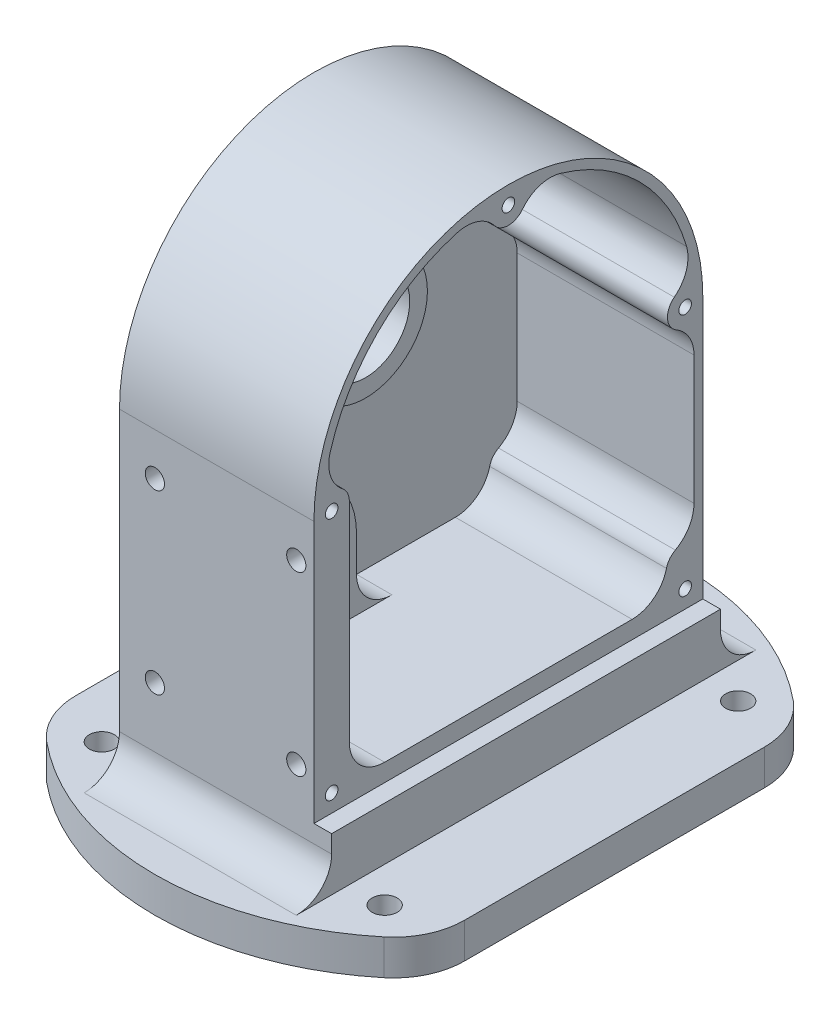
from build123d import *

# Parameters (mm, degrees)
BOSS_EXTRUDE1_DEPTH                               = 17.4625
SKETCH2_R                                         = 11.253999971
CUT_EXTRUDE1_DEPTH                                = 6.35
SKETCH3_R                                         = 5.127000033
CUT_EXTRUDE2_DEPTH                                = 62.154818903
CUT_EXTRUDE3_START                                = -25.4
SKETCH4_R                                         = 11.253999971
CUT_EXTRUDE3_DEPTH                                = 25.4
CSK_FOR_M2_5_FLAT_HEAD_MACHINE_SCREW1_D           = 2.9
CSK_FOR_M2_5_FLAT_HEAD_MACHINE_SCREW1_CSINK_D     = 5.5
CSK_FOR_M2_5_FLAT_HEAD_MACHINE_SCREW1_CSINK_ANGLE = 90
CIRPATTERN1_COUNT                                 = 3
CUT_EXTRUDE4_DEPTH                                = 25.4
CUT_EXTRUDE5_DEPTH                                = 6.35
FILLET1_R                                         = 6.35
SKETCH9_R                                         = 7.9375
CUT_EXTRUDE6_DEPTH                                = 63.701226065
CHAMFER1_SIZE                                     = 1.27
BOSS_EXTRUDE2_START                               = 6.096
SKETCH10_R                                        = 11.1125
SKETCH10_R_2                                      = 7.9375
BOSS_EXTRUDE2_DEPTH                               = 6.096
F_4_40_TAPPED_HOLE2_D                             = 2.2606
F_4_40_TAPPED_HOLE2_DEPTH                         = 12.7
F_4_40_TAPPED_HOLE2_TIP                           = 0.679152758
CUT_EXTRUDE7_DEPTH                                = 25.4
FILLET3_R                                         = 3.175
CUT_EXTRUDE13_DEPTH                               = 6.35
BOSS_EXTRUDE3_DEPTH                               = 15.875
SKETCH22_W                                        = 15.875
SKETCH22_H                                        = 9.525
CUT_EXTRUDE8_DEPTH                                = 107.835329626
CUT_EXTRUDE8_DIRECTION_2_REACH                    = 108.835
F_8_CLEARANCE_HOLE1_D                             = 4.4958
F_8_CLEARANCE_HOLE1_DEPTH                         = 6.35
F_8_CLEARANCE_HOLE1_TIP                           = 1.350674586
SKETCH25_W                                        = 28.575
SKETCH25_H                                        = 63.5
CUT_EXTRUDE9_DEPTH                                = 3.175
SKETCH26_W                                        = 25.4
SKETCH26_H                                        = 57.15
CUT_EXTRUDE10_DEPTH                               = 12.7
FILLET5_R                                         = 3.175
CUT_EXTRUDE11_DEPTH                               = 107.835329626
CUT_EXTRUDE11_DIRECTION_2_REACH                   = 108.835
FILLET7_R                                         = 12.7
FILLET8_R                                         = 3.175
CUT_EXTRUDE12_START                               = -9.525
CUT_EXTRUDE12_DEPTH                               = 9.525
BOSS_EXTRUDE4_REACH                               = 92.083
FILLET11_R                                        = 6.35
F_8_32_TAPPED_HOLE2_D                             = 3.4544
F_8_32_TAPPED_HOLE2_DEPTH                         = 7.62
F_8_32_TAPPED_HOLE2_TIP                           = 1.037806461
FILLET12_R                                        = 6.35
FILLET13_R                                        = 6.35


with BuildPart() as part:
    # Sketch1 → Boss-Extrude1 (new, symmetric)
    with BuildSketch(Plane(origin=(0, 0, 0), x_dir=(0, 0, -1), z_dir=(1, 0, 0))):
        with BuildLine():
            Line((-34.925, 5.715), (-34.925, -41.275))
            Line((-34.925, -41.275), (34.925, -41.275))
            Line((34.925, -41.275), (34.925, 5.715))
            ThreePointArc((34.925, 5.715), (0, 40.64), (-34.925, 5.715))
        make_face()
    extrude(amount=BOSS_EXTRUDE1_DEPTH, both=True)

    # Sketch2 → Cut-Extrude1 (cut)
    with BuildSketch(Plane.ZY.offset(17.4625)):
        with Locations((15.875, -25.393519733)):
            Circle(SKETCH2_R)
    extrude(amount=-CUT_EXTRUDE1_DEPTH, mode=Mode.SUBTRACT)

    # Sketch3 → Cut-Extrude2 (cut, through all)
    with BuildSketch(Plane.ZY.offset(11.1125)):
        with Locations((15.875, -25.393519733)):
            Circle(SKETCH3_R)
    extrude(amount=-CUT_EXTRUDE2_DEPTH, mode=Mode.SUBTRACT)

    # Sketch4 → Cut-Extrude3 (cut)
    with BuildSketch(Plane(origin=(17.4625, 0, 0), x_dir=(0, 0, -1), z_dir=(1, 0, 0)).offset(CUT_EXTRUDE3_START)):
        with Locations(Location((-15.875, -25.393519733, 0), (0, 0, 180))):
            Circle(SKETCH4_R)
    extrude(amount=CUT_EXTRUDE3_DEPTH, mode=Mode.SUBTRACT)

    # CSK for M2.5 Flat Head Machine Screw1 (through all)
    with Locations(Plane(origin=(-7.9375, 0, 0), x_dir=(0, 0, -1), z_dir=(1, 0, 0))):
        with Locations((-15.875, -18.393519733)):
            csk_for_m2_5_flat_head_machine_screw1 = CounterSinkHole(CSK_FOR_M2_5_FLAT_HEAD_MACHINE_SCREW1_D / 2, CSK_FOR_M2_5_FLAT_HEAD_MACHINE_SCREW1_CSINK_D / 2, counter_sink_angle=CSK_FOR_M2_5_FLAT_HEAD_MACHINE_SCREW1_CSINK_ANGLE)

    # CirPattern1: CSK for M2.5 Flat Head Machine Screw1 ×3 about axis
    cirpattern1_axis = Axis((0, -25.393519733, 15.875), (1, 0, 0))
    for i in range(1, CIRPATTERN1_COUNT):
        add(csk_for_m2_5_flat_head_machine_screw1.rotate(cirpattern1_axis, i * 360 / CIRPATTERN1_COUNT), mode=Mode.SUBTRACT)

    # Sketch7 → Cut-Extrude4 (cut)
    with BuildSketch(Plane(origin=(17.4625, 0, 0), x_dir=(0, 0, -1), z_dir=(1, 0, 0))):
        with BuildLine():
            Line((28.575, -38.1), (-28.575, -38.1))
            Line((-28.575, -38.1), (-28.575, 5.715))
            ThreePointArc((-28.575, 5.715), (0, 34.29), (28.575, 5.715))
            Line((28.575, 5.715), (28.575, -38.1))
        make_face()
    extrude(amount=-CUT_EXTRUDE4_DEPTH, mode=Mode.SUBTRACT)

    # Sketch8 → Cut-Extrude5 (cut)
    with BuildSketch(Plane(origin=(-7.9375, 0, 0), x_dir=(0, 0, -1), z_dir=(1, 0, 0))):
        with BuildLine():
            Line((-15.875, -11.393519733), (-28.575, -11.393519733))
            Line((-28.575, -11.393519733), (-28.575, 5.715))
            ThreePointArc((-28.575, 5.715), (0, 34.29), (28.575, 5.715))
            Line((28.575, 5.715), (28.575, -38.1))
            Line((28.575, -38.1), (-1.875, -38.1))
            Line((-1.875, -38.1), (-1.875, -25.393519733))
            ThreePointArc((-1.875, -25.393519733), (-5.975505063, -15.494024797), (-15.875, -11.393519733))
        make_face()
    extrude(amount=-CUT_EXTRUDE5_DEPTH, mode=Mode.SUBTRACT)

    # Fillet1
    fillet1_edges = [part.edges().sort_by_distance(p)[0] for p in [
        (4.7625, -38.1, 28.575),
        (1.5875, -38.1, -28.575),
        (-11.1125, -38.1, 1.875),
        (-11.1125, -11.393519733, 28.575),
    ]]
    fillet(fillet1_edges, radius=FILLET1_R)

    # Sketch9 → Cut-Extrude6 (cut, through all)
    with BuildSketch(Plane(origin=(-14.2875, 0, 0), x_dir=(0, 0, -1), z_dir=(1, 0, 0))):
        with Locations((0, 5.715)):
            Circle(SKETCH9_R)
    extrude(amount=-CUT_EXTRUDE6_DEPTH, mode=Mode.SUBTRACT)

    # Chamfer1
    chamfer1_edges = [part.edges().sort_by_distance(p)[0] for p in [
        (-17.4625, -25.393519733, 4.621000029),
    ]]
    chamfer(chamfer1_edges, length=CHAMFER1_SIZE)

    # Sketch10 → Boss-Extrude2 (add)
    with BuildSketch(Plane(origin=(-14.2875, 0, 0), x_dir=(0, 0, -1), z_dir=(1, 0, 0)).offset(BOSS_EXTRUDE2_START)):
        with Locations((0, 5.715)):
            Circle(SKETCH10_R)
        with Locations((0, 5.715)):
            Circle(SKETCH10_R_2, mode=Mode.SUBTRACT)
    extrude(amount=-BOSS_EXTRUDE2_DEPTH)

    # #4-40 Tapped Hole2
    with Locations(Plane(origin=(17.4625, 0, 0), x_dir=(0, 0, -1), z_dir=(1, 0, 0))):
        with Locations((0, 37.465), (-31.75, 5.715), (31.75, 5.715), (31.75, -38.1), (-31.75, -38.1)):
            Hole(F_4_40_TAPPED_HOLE2_D / 2, depth=F_4_40_TAPPED_HOLE2_DEPTH)
            with Locations((0, 0, -(F_4_40_TAPPED_HOLE2_DEPTH + F_4_40_TAPPED_HOLE2_TIP / 2))):  # 118° drill point
                Cone(0, F_4_40_TAPPED_HOLE2_D / 2, F_4_40_TAPPED_HOLE2_TIP, mode=Mode.SUBTRACT)

    # Sketch17 → Cut-Extrude7 (cut)
    with BuildSketch(Plane(origin=(17.4625, 0, 0), x_dir=(0, 0, -1), z_dir=(1, 0, 0))):
        with BuildLine():
            ThreePointArc((-29.8053125, 8.224744116), (-28.899122257, 7.112541088), (-28.575, 5.715))
            ThreePointArc((-28.575, 5.715), (-20.205576272, 25.920576272), (0, 34.29))
            ThreePointArc((0, 34.29), (-1.397541088, 34.614122257), (-2.509744116, 35.5203125))
            ThreePointArc((-2.509744116, 35.5203125), (-5.565414565, 37.669639324), (-9.30081643, 37.728805147))
            ThreePointArc((-9.30081643, 37.728805147), (-23.573172318, 29.288172318), (-32.013805147, 15.01581643))
            ThreePointArc((-32.013805147, 15.01581643), (-31.954639324, 11.280414565), (-29.8053125, 8.224744116))
        make_face()
        with BuildLine():
            ThreePointArc((2.509744116, 35.5203125), (1.397541088, 34.614122257), (0, 34.29))
            ThreePointArc((0, 34.29), (20.205576272, 25.920576272), (28.575, 5.715))
            ThreePointArc((28.575, 5.715), (28.899122257, 7.112541088), (29.8053125, 8.224744116))
            ThreePointArc((29.8053125, 8.224744116), (31.954639324, 11.280414565), (32.013805147, 15.01581643))
            ThreePointArc((32.013805147, 15.01581643), (23.573172318, 29.288172318), (9.30081643, 37.728805147))
            ThreePointArc((9.30081643, 37.728805147), (5.565414565, 37.669639324), (2.509744116, 35.5203125))
        make_face()
        with BuildLine():
            ThreePointArc((30.1625, 2.965369343), (29.000369343, 4.1275), (28.575, 5.715))
            Line((28.575, 5.715), (28.575, -31.75))
            ThreePointArc((28.575, -31.75), (32.007615786, -29.490203905), (33.3375, -25.601638938))
            Line((33.3375, -25.601638938), (33.3375, -2.533891971))
            ThreePointArc((33.3375, -2.533891971), (32.486761314, 0.641108029), (30.1625, 2.965369343))
        make_face()
        with BuildLine():
            ThreePointArc((-30.1625, 2.965369343), (-32.486761314, 0.641108029), (-33.3375, -2.533891971))
            Line((-33.3375, -2.533891971), (-33.3375, -25.601638938))
            ThreePointArc((-33.3375, -25.601638938), (-32.007615786, -29.490203905), (-28.575, -31.75))
            Line((-28.575, -31.75), (-28.575, 5.715))
            ThreePointArc((-28.575, 5.715), (-29.000369343, 4.1275), (-30.1625, 2.965369343))
        make_face()
    extrude(amount=-CUT_EXTRUDE7_DEPTH, mode=Mode.SUBTRACT)

    # Fillet3
    fillet3_edges = [part.edges().sort_by_distance(p)[0] for p in [
        (4.7625, -31.75, 28.575),
        (4.7625, -31.75, -28.575),
    ]]
    fillet(fillet3_edges, radius=FILLET3_R)

    # Sketch31 → Cut-Extrude13 (cut)
    with BuildSketch(Plane(origin=(-7.9375, 0, 0), x_dir=(0, 0, -1), z_dir=(1, 0, 0))):
        with BuildLine():
            ThreePointArc((-30.1625, 2.965369343), (-32.486761314, 0.641108029), (-33.3375, -2.533891971))
            Line((-33.3375, -2.533891971), (-33.3375, -11.393519733))
            Line((-33.3375, -11.393519733), (-22.225, -11.393519733))
            ThreePointArc((-22.225, -11.393519733), (-26.715128061, -9.533647794), (-28.575, -5.043519733))
            Line((-28.575, -5.043519733), (-28.575, 5.715))
            ThreePointArc((-28.575, 5.715), (-29.000369343, 4.1275), (-30.1625, 2.965369343))
        make_face()
        with BuildLine():
            ThreePointArc((-29.8053125, 8.224744116), (-28.899122257, 7.112541088), (-28.575, 5.715))
            ThreePointArc((-28.575, 5.715), (-20.205576272, 25.920576272), (0, 34.29))
            ThreePointArc((0, 34.29), (-1.397541088, 34.614122257), (-2.509744116, 35.5203125))
            ThreePointArc((-2.509744116, 35.5203125), (-5.565414565, 37.669639324), (-9.30081643, 37.728805147))
            ThreePointArc((-9.30081643, 37.728805147), (-23.573172318, 29.288172318), (-32.013805147, 15.01581643))
            ThreePointArc((-32.013805147, 15.01581643), (-31.954639324, 11.280414565), (-29.8053125, 8.224744116))
        make_face()
        with BuildLine():
            ThreePointArc((2.509744116, 35.5203125), (1.397541088, 34.614122257), (0, 34.29))
            ThreePointArc((0, 34.29), (20.205576272, 25.920576272), (28.575, 5.715))
            ThreePointArc((28.575, 5.715), (28.899122257, 7.112541088), (29.8053125, 8.224744116))
            ThreePointArc((29.8053125, 8.224744116), (31.954639324, 11.280414565), (32.013805147, 15.01581643))
            ThreePointArc((32.013805147, 15.01581643), (23.573172318, 29.288172318), (9.30081643, 37.728805147))
            ThreePointArc((9.30081643, 37.728805147), (5.565414565, 37.669639324), (2.509744116, 35.5203125))
        make_face()
        with BuildLine():
            ThreePointArc((30.1625, 2.965369343), (29.000369343, 4.1275), (28.575, 5.715))
            Line((28.575, 5.715), (28.575, -31.75))
            ThreePointArc((28.575, -31.75), (28.529894241, -32.505518767), (28.395217762, -33.250304227))
            ThreePointArc((28.395217762, -33.250304227), (28.97026875, -32.056173857), (29.982717762, -31.20085054))
            ThreePointArc((29.982717762, -31.20085054), (32.43461542, -28.865292352), (33.3375, -25.601638938))
            Line((33.3375, -25.601638938), (33.3375, -2.533891971))
            ThreePointArc((33.3375, -2.533891971), (32.486761314, 0.641108029), (30.1625, 2.965369343))
        make_face()
    extrude(amount=-CUT_EXTRUDE13_DEPTH, mode=Mode.SUBTRACT)

    # Sketch21 → Boss-Extrude3 (add)
    with BuildSketch(Plane.XZ.offset(41.275)):
        with BuildLine():
            Line((-33.3375, -32.378773911), (-33.3375, 32.378773911))
            ThreePointArc((-33.3375, 32.378773911), (1.5875, 47.625), (36.5125, 32.378773911))
            Line((36.5125, 32.378773911), (36.5125, -32.378773911))
            ThreePointArc((36.5125, -32.378773911), (1.5875, -47.625), (-33.3375, -32.378773911))
        make_face()
    extrude(amount=BOSS_EXTRUDE3_DEPTH)

    # Sketch22 → Cut-Extrude8 (cut)
    with BuildSketch(Plane.XY.offset(34.925)):
        with Locations((28.575, -46.0375)):
            Rectangle(SKETCH22_W, SKETCH22_H)
    cut_extrude8 = extrude(amount=-CUT_EXTRUDE8_DEPTH, mode=Mode.SUBTRACT)

    # Sketch22 → Cut-Extrude8 direction 2 (cut, up to next)
    with BuildSketch(Plane.XY.offset(34.925), mode=Mode.PRIVATE) as cut_extrude8_direction_2_sk1:
        with Locations((28.575, -46.0375)):
            Rectangle(SKETCH22_W, SKETCH22_H)
    cut_extrude8_direction_2_tool1 = extrude(cut_extrude8_direction_2_sk1.sketch, amount=CUT_EXTRUDE8_DIRECTION_2_REACH, mode=Mode.PRIVATE) & part.part
    cut_extrude8_direction_2 = cut_extrude8_direction_2_tool1.solids().sort_by_distance((28.575, -46.0375, 34.925))[0]
    add(cut_extrude8_direction_2, mode=Mode.SUBTRACT)

    # Mirror1: Cut-Extrude8, Cut-Extrude8 direction 2 across plane
    add(cut_extrude8.mirror(Plane(origin=(0, 0, 0), x_dir=(0, 0, 1), z_dir=(1, 0, 0))), mode=Mode.SUBTRACT)
    add(cut_extrude8_direction_2.mirror(Plane(origin=(0, 0, 0), x_dir=(0, 0, 1), z_dir=(1, 0, 0))), mode=Mode.SUBTRACT)

    # #8 Clearance Hole1
    with Locations(Plane.XZ.offset(57.15)):
        with Locations((26.9875, 31.75), (-23.8125, 31.75), (-23.8125, -31.75), (26.9875, -31.75)):
            Hole(F_8_CLEARANCE_HOLE1_D / 2, depth=F_8_CLEARANCE_HOLE1_DEPTH)
            with Locations((0, 0, -(F_8_CLEARANCE_HOLE1_DEPTH + F_8_CLEARANCE_HOLE1_TIP / 2))):  # 118° drill point
                Cone(0, F_8_CLEARANCE_HOLE1_D / 2, F_8_CLEARANCE_HOLE1_TIP, mode=Mode.SUBTRACT)

    # Sketch25 → Cut-Extrude9 (cut)
    with BuildSketch(Plane.XZ.offset(57.15)):
        Rectangle(SKETCH25_W, SKETCH25_H)
    extrude(amount=-CUT_EXTRUDE9_DEPTH, mode=Mode.SUBTRACT)

    # Sketch26 → Cut-Extrude10 (cut)
    with BuildSketch(Plane.XZ.offset(53.975)):
        Rectangle(SKETCH26_W, SKETCH26_H)
    extrude(amount=-CUT_EXTRUDE10_DEPTH, mode=Mode.SUBTRACT)

    # Fillet5
    fillet5_edges = [part.edges().sort_by_distance(p)[0] for p in [
        (14.2875, -55.5625, 31.75),
        (14.2875, -55.5625, -31.75),
        (-14.2875, -55.5625, -31.75),
        (-14.2875, -55.5625, 31.75),
        (12.7, -47.625, 28.575),
        (12.7, -47.625, -28.575),
        (-12.7, -47.625, -28.575),
        (-12.7, -47.625, 28.575),
        (12.7, -41.275, 0),
        (0, -41.275, -28.575),
        (-12.7, -41.275, 0),
        (0, -41.275, 28.575),
    ]]
    fillet(fillet5_edges, radius=FILLET5_R)

    # Sketch28 → Cut-Extrude11 (cut)
    with BuildSketch(Plane.XY.offset(34.925)):
        Polygon((-17.4625, -41.275), (-17.4625, -50.8), (-33.3375, -50.8), (-20.6375, -41.275), align=None)
    extrude(amount=-CUT_EXTRUDE11_DEPTH, mode=Mode.SUBTRACT)

    # Sketch28 → Cut-Extrude11 direction 2 (cut, up to next)
    with BuildSketch(Plane.XY.offset(34.925), mode=Mode.PRIVATE) as cut_extrude11_direction_2_sk1:
        Polygon((-17.4625, -41.275), (-17.4625, -50.8), (-33.3375, -50.8), (-20.6375, -41.275), align=None)
    cut_extrude11_direction_2_tool1 = extrude(cut_extrude11_direction_2_sk1.sketch, amount=CUT_EXTRUDE11_DIRECTION_2_REACH, mode=Mode.PRIVATE) & part.part
    add(cut_extrude11_direction_2_tool1.solids().sort_by_distance((-22.930556, -47.095833, 34.925))[0], mode=Mode.SUBTRACT)

    # Fillet7
    fillet7_edges = [part.edges().sort_by_distance(p)[0] for p in [
        (-33.3375, -53.975, -32.378773911),
        (36.5125, -53.975, -32.378773911),
        (36.5125, -53.975, 32.378773911),
        (-33.3375, -53.975, 32.378773911),
    ]]
    fillet(fillet7_edges, radius=FILLET7_R)

    # Fillet8
    fillet8_edges = [part.edges().sort_by_distance(p)[0] for p in [
        (-14.2875, 5.715, 11.1125),
    ]]
    fillet(fillet8_edges, radius=FILLET8_R)

    # Sketch30 → Cut-Extrude12 (cut)
    with BuildSketch(Plane(origin=(0, -41.275, 0), x_dir=(1, 0, 0), z_dir=(0, 1, 0)).offset(CUT_EXTRUDE12_START)):
        with BuildLine():
            Line((20.6375, 34.925), (-17.4625, 34.925))
            Line((-17.4625, 34.925), (-17.4625, 43.649033494))
            ThreePointArc((-17.4625, 43.649033494), (1.5875, 47.625), (20.6375, 43.649033494))
            Line((20.6375, 43.649033494), (20.6375, 34.925))
        make_face()
        with BuildLine():
            Line((20.6375, -43.649033494), (20.6375, -34.925))
            Line((20.6375, -34.925), (-17.4625, -34.925))
            Line((-17.4625, -34.925), (-17.4625, -43.649033494))
            ThreePointArc((-17.4625, -43.649033494), (1.5875, -47.625), (20.6375, -43.649033494))
        make_face()
    extrude(amount=CUT_EXTRUDE12_DEPTH, mode=Mode.SUBTRACT)

    # Boss-Extrude4: up to this face of the body (flat: up to its plane)
    boss_extrude4_end = Plane(part.part.faces().sort_by_distance((-14.2875, 5.715, 15.299125656))[0])
    # Sketch33 → Boss-Extrude4 (add, up to the picked face)
    with BuildSketch(Plane(origin=(17.4625, 0, 0), x_dir=(0, 0, -1), z_dir=(1, 0, 0)), mode=Mode.PRIVATE) as boss_extrude4_sk1:
        with BuildLine():
            Line((-28.582296907, 5.499867214), (-28.582296907, -32.703518156))
            ThreePointArc((-28.582296907, -32.703518156), (-29.157631612, -31.835805607), (-29.982717762, -31.20085054))
            ThreePointArc((-29.982717762, -31.20085054), (-32.43461542, -28.865292352), (-33.3375, -25.601638938))
            Line((-33.3375, -25.601638938), (-33.3375, -2.533891971))
            ThreePointArc((-33.3375, -2.533891971), (-32.486761314, 0.641108029), (-30.1625, 2.965369343))
            ThreePointArc((-30.1625, 2.965369343), (-29.055763749, 4.035203577), (-28.582296907, 5.499867214))
        make_face()
    boss_extrude4_tool1 = split(extrude(boss_extrude4_sk1.sketch, amount=-BOSS_EXTRUDE4_REACH, mode=Mode.PRIVATE), bisect_by=boss_extrude4_end, keep=Keep.BOTH, mode=Mode.PRIVATE)
    add(boss_extrude4_tool1.solids().sort_by(Axis((17.4625, -14.034093, 30.834221), (-1, 0, 0)))[0])

    # Fillet11
    fillet11_edges = [part.edges().sort_by_distance(p)[0] for p in [
        (4.7625, -32.703518156, 28.582296907),
    ]]
    fillet(fillet11_edges, radius=FILLET11_R)

    # #8-32 Tapped Hole2
    with Locations(Plane.XY.offset(34.925)):
        with Locations((-11.1125, -1.905), (14.2875, -1.905), (-11.1125, -33.655), (14.2875, -33.655)):
            Hole(F_8_32_TAPPED_HOLE2_D / 2, depth=F_8_32_TAPPED_HOLE2_DEPTH)
            with Locations((0, 0, -(F_8_32_TAPPED_HOLE2_DEPTH + F_8_32_TAPPED_HOLE2_TIP / 2))):  # 118° drill point
                Cone(0, F_8_32_TAPPED_HOLE2_D / 2, F_8_32_TAPPED_HOLE2_TIP, mode=Mode.SUBTRACT)

    # Fillet12
    fillet12_edges = [part.edges().sort_by_distance(p)[0] for p in [
        (-11.1125, -11.393519733, 28.582296907),
    ]]
    fillet(fillet12_edges, radius=FILLET12_R)

    # Fillet13
    fillet13_edges = [part.edges().sort_by_distance(p)[0] for p in [
        (1.5875, -50.8, 34.925),
        (1.5875, -50.8, -34.925),
    ]]
    fillet(fillet13_edges, radius=FILLET13_R)


solid = part.part
